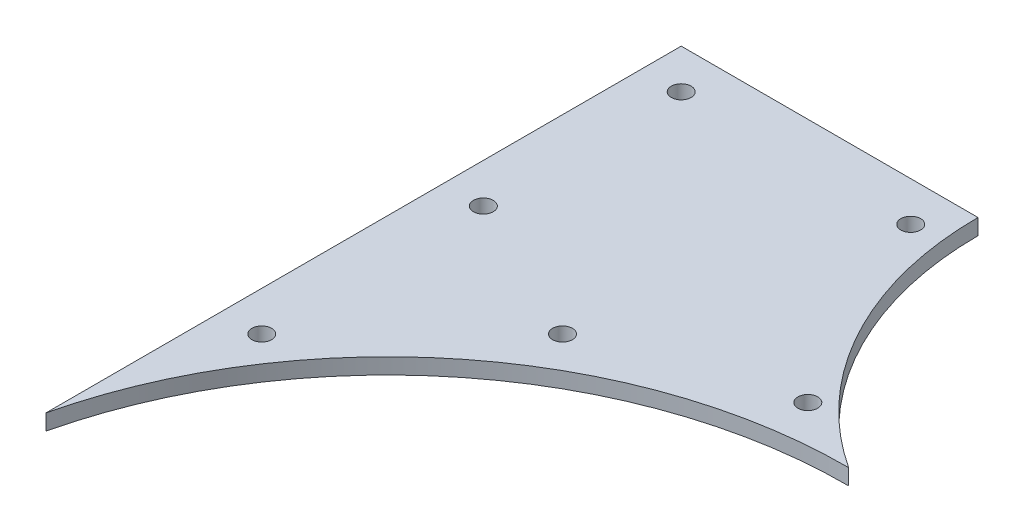
from build123d import *

# Parameters (mm, degrees)
BOSS_EXTRUDE1_DEPTH = 5.08
SKETCH2_R           = 3.175
CUT_EXTRUDE1_DEPTH  = 5.08


with BuildPart() as part:
    # Sketch1 → Boss-Extrude1 (new body)
    with BuildSketch(Plane(origin=(0, 0, 0), x_dir=(1, 0, 0), z_dir=(0, 1, 0))):
        with BuildLine():
            Line((-203.2, 381), (-203.2, 177.143917216))
            ThreePointArc((-203.2, 177.143917216), (-151.025197649, 259.077837422), (-59.18865855, 290.723174629))
            ThreePointArc((-59.18865855, 290.723174629), (-94.980572199, 329.698017536), (-107.95, 381))
            Line((-107.95, 381), (-203.2, 381))
        make_face()
    extrude(amount=BOSS_EXTRUDE1_DEPTH)

    # Sketch2 → Cut-Extrude1 (cut)
    with BuildSketch(Plane(origin=(0, 5.08, 0), x_dir=(1, 0, 0), z_dir=(0, 1, 0))):
        with Locations(Location((-190.5, 233.68, 0), (0, 0, 270))):
            Circle(SKETCH2_R)
        with Locations(Location((-83.82, 302.26, 0), (0, 0, 270))):
            Circle(SKETCH2_R)
        with Locations(Location((-116.84, 368.3, 0), (0, 0, 270))):
            Circle(SKETCH2_R)
        with Locations(Location((-190.5, 368.3, 0), (0, 0, 270))):
            Circle(SKETCH2_R)
        with Locations(Location((-142.24, 281.94, 0), (0, 0, 270))):
            Circle(SKETCH2_R)
        with Locations(Location((-190.5, 304.8, 0), (0, 0, 270))):
            Circle(SKETCH2_R)
    extrude(amount=-CUT_EXTRUDE1_DEPTH, mode=Mode.SUBTRACT)


solid = part.part
